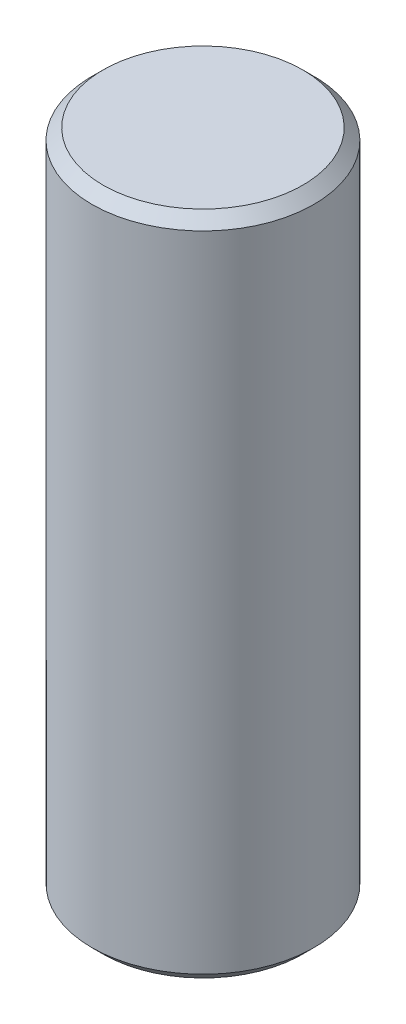
from build123d import *

# Parameters (mm, degrees)
SKETCH1_R           = 20
BOSS_EXTRUDE1_DEPTH = 120
CHAMFER1_SIZE       = 2


with BuildPart() as part:
    # Sketch1 → Boss-Extrude1 (new body)
    with BuildSketch(Plane(origin=(0, 0, 0), x_dir=(1, 0, 0), z_dir=(0, 1, 0))):
        with Locations(Location((0, 0, 0), (0, 0, 270))):
            Circle(SKETCH1_R)
    extrude(amount=BOSS_EXTRUDE1_DEPTH)

    # Chamfer1
    chamfer1_edges = [part.edges().sort_by_distance(p)[0] for p in [
        (0, 0, -20),
        (0, 120, -20),
    ]]
    chamfer(chamfer1_edges, length=CHAMFER1_SIZE)


solid = part.part
